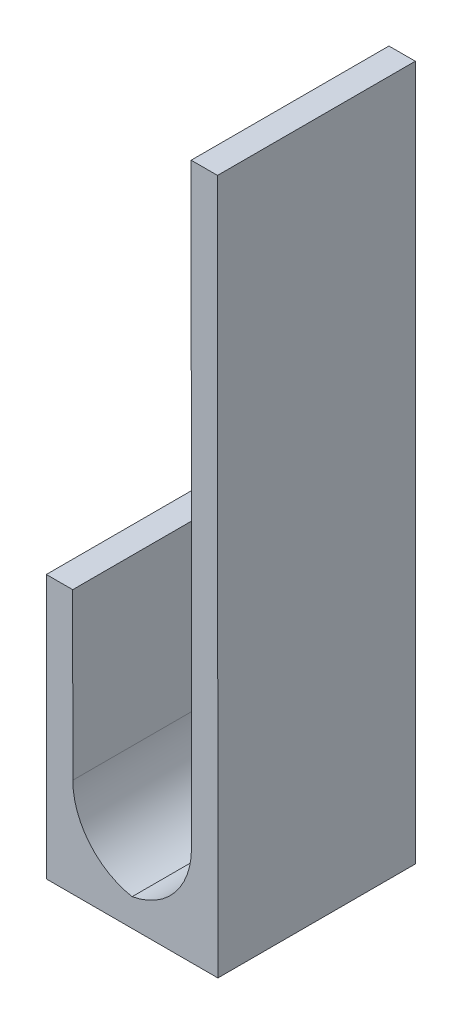
from build123d import *

# Parameters (mm, degrees)
BOSS_EXTRUDE1_DEPTH = 15


with BuildPart() as part:
    # Sketch1 → Boss-Extrude1 (new body)
    with BuildSketch(Plane.XY):
        with BuildLine():
            Line((0, 0), (13.001019729, 0))
            Line((13.001019729, 0), (12.974193154, 52.70215653))
            Line((12.974193154, 52.70215653), (10.974193413, 52.701138486))
            Line((10.974193413, 52.701138486), (10.997204677, 7.494352092))
            ThreePointArc((10.997204677, 7.494352092), (9.725689165, 3.977520123), (6.497205517, 2.090259641))
            ThreePointArc((6.497205517, 2.090259641), (3.270511139, 3.975372484), (1.997206357, 7.488761443))
            Line((1.997206357, 7.488761443), (1.99083734, 20.001015713))
            Line((1.99083734, 20.001015713), (-0.009162401, 19.999997668))
            Line((-0.009162401, 19.999997668), (0, 2))
            Line((0, 2), (0, 0))
        make_face()
    extrude(amount=BOSS_EXTRUDE1_DEPTH)


solid = part.part
